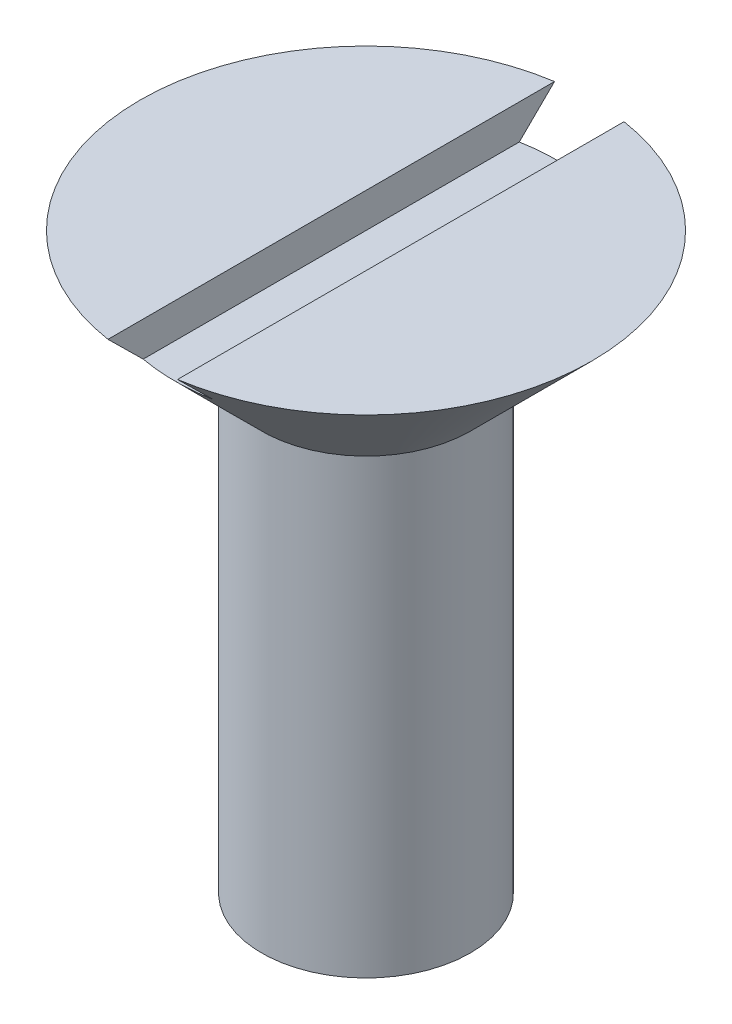
from build123d import *

# Parameters (mm, degrees)
SKETCH3_W          = 2
SKETCH3_H          = 2
CUT_EXTRUDE1_DEPTH = 15


with BuildPart() as part:
    # Sketch2 → Revolve1 (revolve)
    with BuildSketch(Plane.XY, mode=Mode.PRIVATE) as revolve1_sk:
        Polygon((0, -1.23273041), (6.5, -1.23273041), (3, -4.73273041), (3, -17.73273041), (0, -19.464781218), align=None)
    revolve(revolve1_sk.sketch.rotate(Axis((0, -1.23273041, 0), (0, -1, 0)), 180), axis=Axis((0, -1.23273041, 0), (0, -1, 0)))

    # Sketch3 → Cut-Extrude1 (cut, symmetric)
    with BuildSketch(Plane.XY):
        with Locations((0, -1.23273041)):
            Rectangle(SKETCH3_W, SKETCH3_H)
    extrude(amount=CUT_EXTRUDE1_DEPTH, both=True, mode=Mode.SUBTRACT)


solid = part.part
